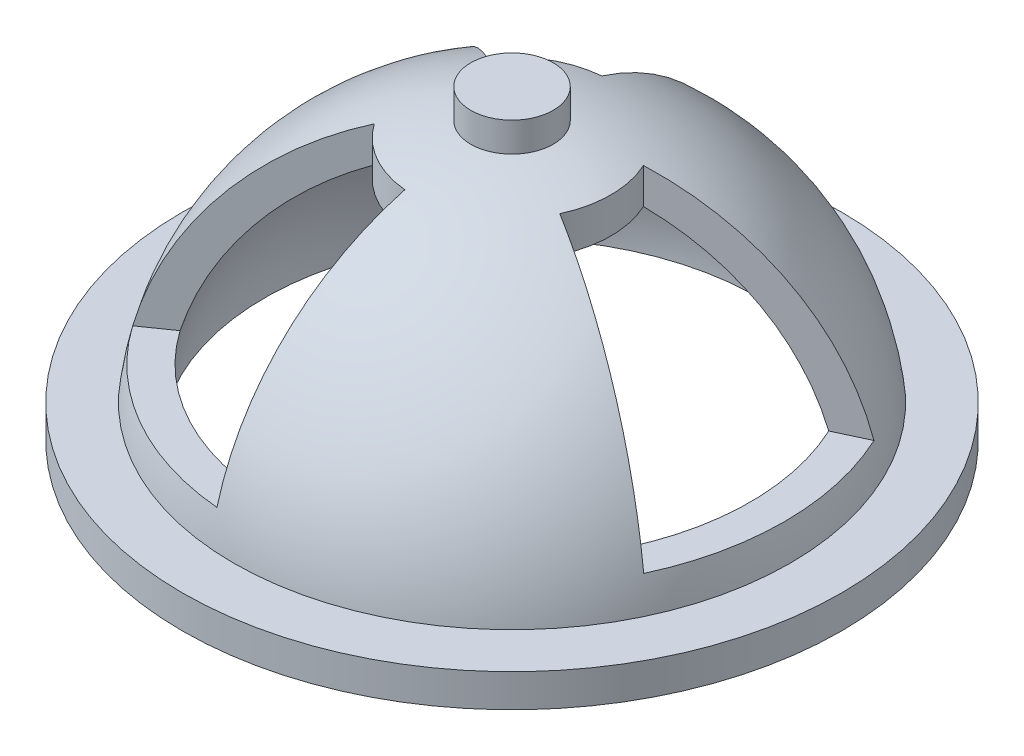
from build123d import *

# Parameters (mm, degrees)
CUT_EXTRUDE_1_REACH      = 96.63
CUT_EXTRUDE_1_END_RADIUS = 42.5
CUT_EXTRUDE_START        = 10


with BuildPart() as part:
    # 草图1 → 旋转2 (revolve)
    with BuildSketch(Plane(origin=(0, 0, 0), x_dir=(0, 0, -1), z_dir=(1, 0, 0))):
        with BuildLine():
            Line((0, 46.5), (0, 37.5))
            ThreePointArc((0, 37.5), (-26.516504294, 26.516504294), (-37.5, 0))
            Line((-37.5, 0), (-50, 0))
            Line((-50, 0), (-50, 5))
            Line((-50, 5), (-42.20485754, 5))
            ThreePointArc((-42.20485754, 5), (-30.49459553, 29.60286546), (-6.25, 42.037929302))
            Line((-6.25, 42.037929302), (-6.25, 46.5))
            Line((-6.25, 46.5), (0, 46.5))
        make_face()
    revolve(axis=Axis((0, 58.334015454, 0), (0, -1, 0)))

    # 切除-拉伸1: up to this sphere (the profile starts inside it)
    cut_extrude_1_end = Location((0, 0, 0)) * Sphere(CUT_EXTRUDE_1_END_RADIUS, mode=Mode.PRIVATE)
    # 草图2 → 切除-拉伸1 (cut, up to the surface)
    with BuildSketch(Plane(origin=(0, 0, 0), x_dir=(1, 0, 0), z_dir=(0, 1, 0)).offset(CUT_EXTRUDE_START), mode=Mode.PRIVATE) as cut_extrude_1_sk1:
        with BuildLine():
            Line((-1.307336141, -14.942920471), (-3.647837191, -41.694969886))
            ThreePointArc((-3.647837191, -41.694969886), (-20.927118949, -36.246833275), (-34.284984536, -24.006604619))
            Line((-34.284984536, -24.006604619), (-12.287280664, -8.603646545))
            ThreePointArc((-12.287280664, -8.603646545), (-7.5, -12.990381057), (-1.307336141, -14.942920471))
        make_face()
    cut_extrude_1_tool1 = extrude(cut_extrude_1_sk1.sketch, amount=CUT_EXTRUDE_1_REACH, mode=Mode.PRIVATE) & cut_extrude_1_end
    add(cut_extrude_1_tool1.solids().sort_by_distance((-14.790617, 10, 25.6181))[0], mode=Mode.SUBTRACT)
    # 草图2 → 切除-拉伸1 (cut, up to the surface)
    with BuildSketch(Plane(origin=(0, 0, 0), x_dir=(1, 0, 0), z_dir=(0, 1, 0)).offset(CUT_EXTRUDE_START), mode=Mode.PRIVATE) as cut_extrude_1_sk2:
        with BuildLine():
            Line((13.594616806, 6.339273926), (37.932821727, 17.688365267))
            ThreePointArc((37.932821727, 17.688365267), (41.854237898, 0), (37.932821727, -17.688365267))
            Line((37.932821727, -17.688365267), (13.594616806, -6.339273926))
            ThreePointArc((13.594616806, -6.339273926), (15, 0), (13.594616806, 6.339273926))
        make_face()
    cut_extrude_1_tool2 = extrude(cut_extrude_1_sk2.sketch, amount=CUT_EXTRUDE_1_REACH, mode=Mode.PRIVATE) & cut_extrude_1_end
    add(cut_extrude_1_tool2.solids().sort_by_distance((29.581234, 10, 0))[0], mode=Mode.SUBTRACT)
    # 草图2 → 切除-拉伸1 (cut, up to the surface)
    with BuildSketch(Plane(origin=(0, 0, 0), x_dir=(1, 0, 0), z_dir=(0, 1, 0)).offset(CUT_EXTRUDE_START), mode=Mode.PRIVATE) as cut_extrude_1_sk3:
        with BuildLine():
            Line((-12.287280664, 8.603646545), (-34.284984536, 24.006604619))
            ThreePointArc((-34.284984536, 24.006604619), (-20.927118949, 36.246833275), (-3.647837191, 41.694969886))
            Line((-3.647837191, 41.694969886), (-1.307336141, 14.942920471))
            ThreePointArc((-1.307336141, 14.942920471), (-7.5, 12.990381057), (-12.287280664, 8.603646545))
        make_face()
    cut_extrude_1_tool3 = extrude(cut_extrude_1_sk3.sketch, amount=CUT_EXTRUDE_1_REACH, mode=Mode.PRIVATE) & cut_extrude_1_end
    add(cut_extrude_1_tool3.solids().sort_by_distance((-14.790617, 10, -25.6181))[0], mode=Mode.SUBTRACT)


solid = part.part
